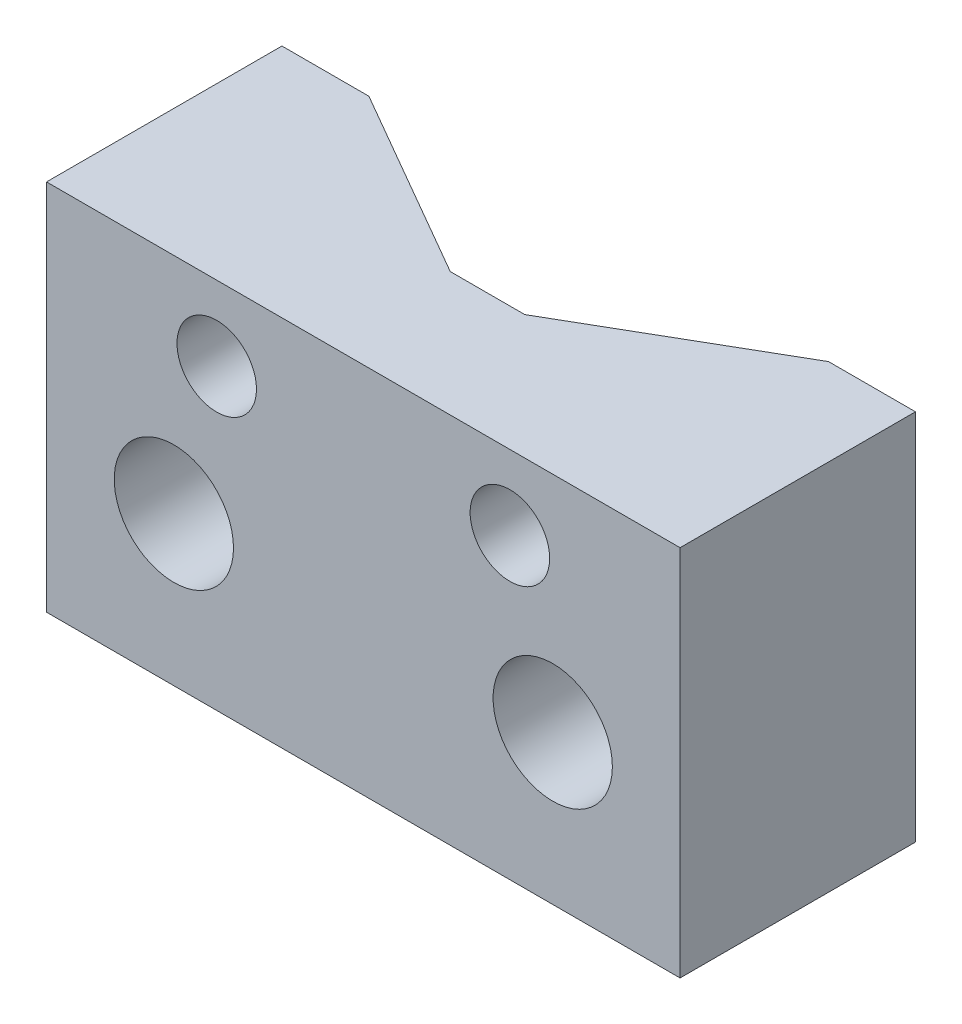
from build123d import *

# Parameters (mm, degrees)
BOSS_EXTRUDE1_DEPTH = 15
SKETCH2_R           = 1.6
SKETCH2_R_2         = 2.4
CUT_EXTRUDE1_DEPTH  = 22.847836945


with BuildPart() as part:
    # Sketch1 → Boss-Extrude1 (new body)
    with BuildSketch(Plane(origin=(0, 0, 0), x_dir=(1, 0, 0), z_dir=(0, 1, 0))):
        Polygon((0, 0), (10.25, 0), (12.75, 0), (12.75, 9.474464586), (9.25, 9.474464586), (1.5, 5), (0, 5), (-1.5, 5), (-9.25, 9.474464586), (-12.75, 9.474464586), (-12.75, 0), (-10.25, 0), align=None)
    extrude(amount=BOSS_EXTRUDE1_DEPTH)

    # Sketch2 → Cut-Extrude1 (cut, through all)
    with BuildSketch(Plane.XY):
        with Locations((-5.9, 12)):
            Circle(SKETCH2_R)
        with Locations((5.9, 12)):
            Circle(SKETCH2_R)
        with Locations((-7.625, 6)):
            Circle(SKETCH2_R_2)
        with Locations((7.625, 6)):
            Circle(SKETCH2_R_2)
    extrude(amount=-CUT_EXTRUDE1_DEPTH, mode=Mode.SUBTRACT)


solid = part.part
